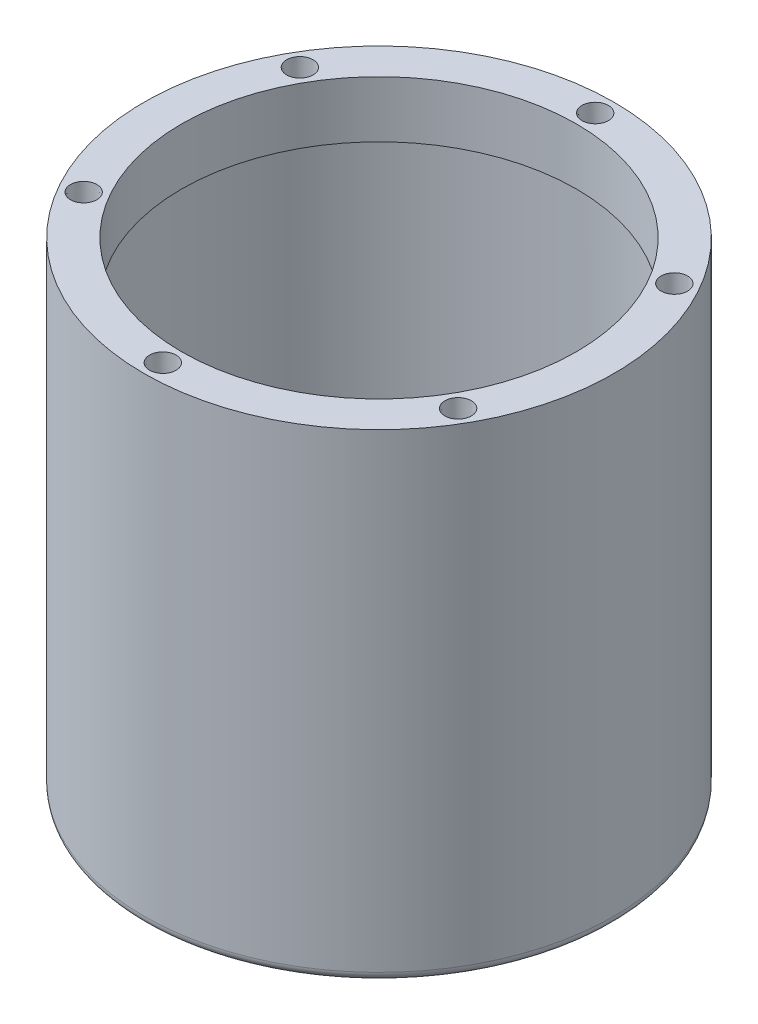
from build123d import *

# Parameters (mm, degrees)
BOSS_EXTRUDE1_START                = -15.24
SKETCH2_R                          = 60.96
SKETCH2_R_2                        = 53.34
BOSS_EXTRUDE1_DEPTH                = 15.24
F_1_16_NPT_TAPPED_HOLE2_AT_2_COUNT = 2
F_1_16_NPT_TAPPED_HOLE2_AT_2_PITCH = 58.42
F_1_16_NPT_TAPPED_HOLE2_AT_3_COUNT = 2
F_1_16_NPT_TAPPED_HOLE2_AT_3_PITCH = 101.186408178
F_1_16_NPT_TAPPED_HOLE2_AT_4_COUNT = 2
F_1_16_NPT_TAPPED_HOLE2_AT_4_PITCH = 116.84
F_1_16_NPT_TAPPED_HOLE2_AT_5_COUNT = 2
F_1_16_NPT_TAPPED_HOLE2_AT_5_PITCH = 101.186408178
F_1_16_NPT_TAPPED_HOLE2_AT_6_COUNT = 2
F_1_16_NPT_TAPPED_HOLE2_AT_6_PITCH = 58.42
SKETCH8_R                          = 25.4
CUT_EXTRUDE1_DEPTH                 = 2.54


with BuildPart() as part:
    # Sketch1 → Revolve1 (revolve)
    with BuildSketch(Plane.XY, mode=Mode.PRIVATE) as revolve1_sk:
        with BuildLine():
            Line((0, 0), (60.96, 0))
            Line((60.96, 0), (60.96, -2.54))
            ThreePointArc((60.96, -2.54), (62.756051224, -1.796051224), (63.5, 0))
            Line((63.5, 0), (63.5, 127))
            Line((63.5, 127), (60.96, 127))
            Line((60.96, 127), (60.96, 2.54))
            Line((60.96, 2.54), (0, 2.54))
            Line((0, 2.54), (0, 0))
        make_face()
    revolve(revolve1_sk.sketch.rotate(Axis((0, 0, 0), (0, 1, 0)), 90), axis=Axis((0, 0, 0), (0, 1, 0)))

    # Sketch2 → Boss-Extrude1 (add)
    with BuildSketch(Plane(origin=(0, 127, 0), x_dir=(1, 0, 0), z_dir=(0, 1, 0)).offset(BOSS_EXTRUDE1_START)):
        with Locations(Location((0, 0, 0), (0, 0, 90))):
            Circle(SKETCH2_R)
        with Locations(Location((0, 0, 0), (0, 0, 270))):
            Circle(SKETCH2_R_2, mode=Mode.SUBTRACT)
    extrude(amount=BOSS_EXTRUDE1_DEPTH)

    # Sketch7 → 1/16 NPT Tapped Hole2 (revolve, cut)
    with BuildSketch(Plane(origin=(0, 127, -58.42), x_dir=(0, 0, 1), z_dir=(1, 0, 0))):
        Polygon((0, 0), (0, 13.530685027), (3.0734, 11.684), (3.0734, 6.858), (3.364810096, 6.858), (3.5701478, 0), align=None)
    f_1_16_npt_tapped_hole2 = revolve(axis=Axis((0, 133.35, -58.42), (0, -1, 0)), mode=Mode.SUBTRACT)

    # 1/16 NPT Tapped Hole2 at 2: 1/16 NPT Tapped Hole2 ×2
    with Locations(*[Vector(-0.8660254037844416, 0, 0.499999999999995) * (i * F_1_16_NPT_TAPPED_HOLE2_AT_2_PITCH) for i in range(1, F_1_16_NPT_TAPPED_HOLE2_AT_2_COUNT)]):
        add(f_1_16_npt_tapped_hole2, mode=Mode.SUBTRACT)

    # 1/16 NPT Tapped Hole2 at 3: 1/16 NPT Tapped Hole2 ×2
    with Locations(*[Vector(-0.5000000000000038, 0, 0.8660254037844365) * (i * F_1_16_NPT_TAPPED_HOLE2_AT_3_PITCH) for i in range(1, F_1_16_NPT_TAPPED_HOLE2_AT_3_COUNT)]):
        add(f_1_16_npt_tapped_hole2, mode=Mode.SUBTRACT)

    # 1/16 NPT Tapped Hole2 at 4: 1/16 NPT Tapped Hole2 ×2
    with Locations(*[(0, 0, i * F_1_16_NPT_TAPPED_HOLE2_AT_4_PITCH) for i in range(1, F_1_16_NPT_TAPPED_HOLE2_AT_4_COUNT)]):
        add(f_1_16_npt_tapped_hole2, mode=Mode.SUBTRACT)

    # 1/16 NPT Tapped Hole2 at 5: 1/16 NPT Tapped Hole2 ×2
    with Locations(*[Vector(0.49999999999999206, 0, 0.8660254037844433) * (i * F_1_16_NPT_TAPPED_HOLE2_AT_5_PITCH) for i in range(1, F_1_16_NPT_TAPPED_HOLE2_AT_5_COUNT)]):
        add(f_1_16_npt_tapped_hole2, mode=Mode.SUBTRACT)

    # 1/16 NPT Tapped Hole2 at 6: 1/16 NPT Tapped Hole2 ×2
    with Locations(*[Vector(0.8660254037844346, 0, 0.500000000000007) * (i * F_1_16_NPT_TAPPED_HOLE2_AT_6_PITCH) for i in range(1, F_1_16_NPT_TAPPED_HOLE2_AT_6_COUNT)]):
        add(f_1_16_npt_tapped_hole2, mode=Mode.SUBTRACT)

    # Sketch8 → Cut-Extrude1 (cut)
    with BuildSketch(Plane.XZ):
        with Locations(Location((0, 0, 0), (0, 0, 270))):
            Circle(SKETCH8_R)
    extrude(amount=-CUT_EXTRUDE1_DEPTH, mode=Mode.SUBTRACT)


solid = part.part
